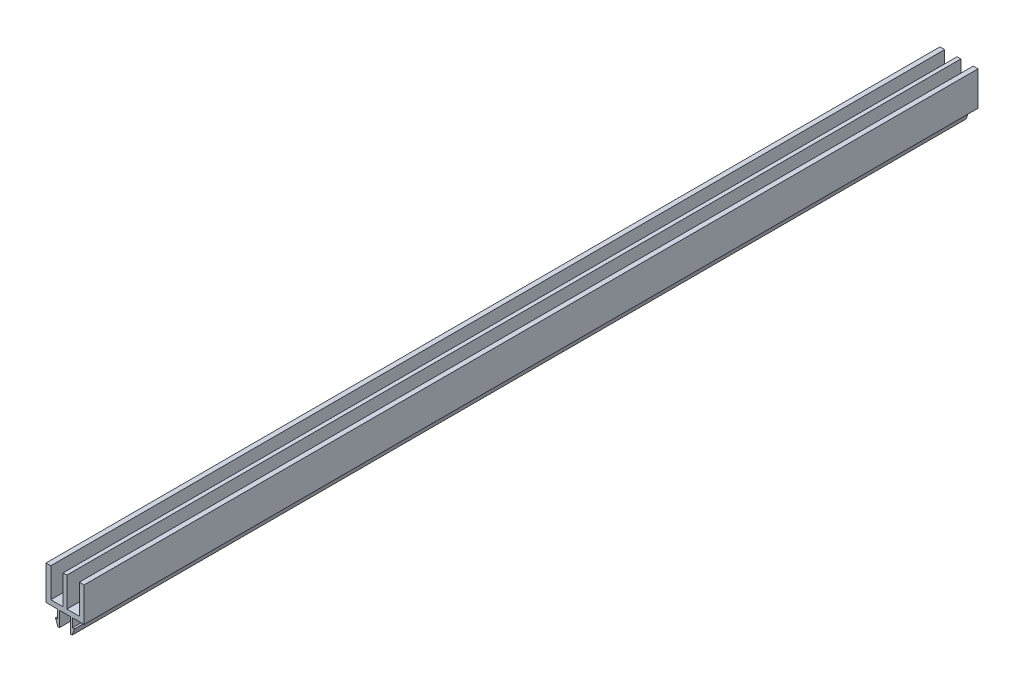
from build123d import *

# Parameters (mm, degrees)
BOSS_EXTRU_1_DEPTH = 470


with BuildPart() as part:
    # Esquisse1 → Boss.-Extru.1 (new body)
    with BuildSketch(Plane.XY.offset(50)):
        Polygon((-1, 2.5), (-7.5, 2.5), (-7.5, 17.999999998), (-10, 17.999999998), (-10, 0), (-4, 0), (-4, -4.5), (-5, -4.5), (-3.75, -8), (-3, -8), (-3, 0), (3, 0), (3, -8), (3.75, -8), (5, -4.5), (4, -4.5), (4, 0), (10, 0), (10, 17.999999998), (7.5, 17.999999998), (7.5, 2.5), (1, 2.5), (1, 17.999999998), (-1, 17.999999998), align=None)
    extrude(amount=-BOSS_EXTRU_1_DEPTH)


solid = part.part
